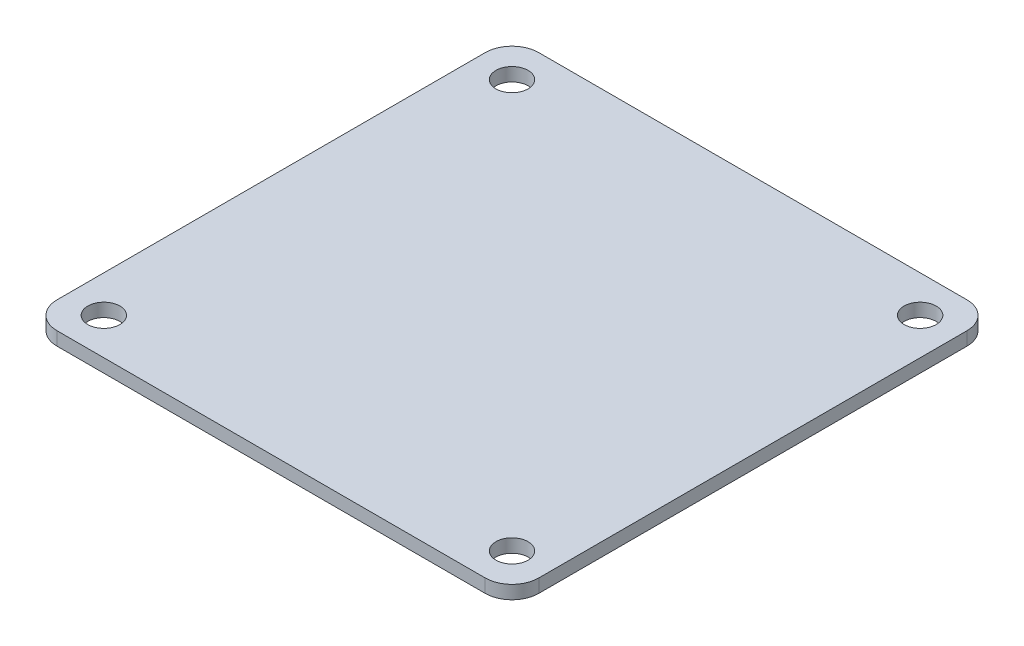
from build123d import *

# Parameters (mm, degrees)
SKETCH1_W            = 36
SKETCH1_H            = 36
BOSS_EXTRUDE1_DEPTH  = 1
M2_CLEARANCE_HOLE1_D = 2.4
FILLET1_R            = 2


with BuildPart() as part:
    # Sketch1 → Boss-Extrude1 (new body)
    with BuildSketch(Plane(origin=(0, 0, 0), x_dir=(1, 0, 0), z_dir=(0, 1, 0))):
        Rectangle(SKETCH1_W, SKETCH1_H)
    extrude(amount=BOSS_EXTRUDE1_DEPTH)

    # M2 Clearance Hole1 (through all)
    with Locations(Plane(origin=(0, 1, 0), x_dir=(1, 0, 0), z_dir=(0, 1, 0))):
        with Locations((-15.25, 15.25), (15.25, 15.25), (15.25, -15.25), (-15.25, -15.25)):
            Hole(M2_CLEARANCE_HOLE1_D / 2)

    # Fillet1
    fillet1_edges = [part.edges().sort_by_distance(p)[0] for p in [
        (-18, 0.5, -18),
        (18, 0.5, -18),
        (18, 0.5, 18),
        (-18, 0.5, 18),
    ]]
    fillet(fillet1_edges, radius=FILLET1_R)


solid = part.part
